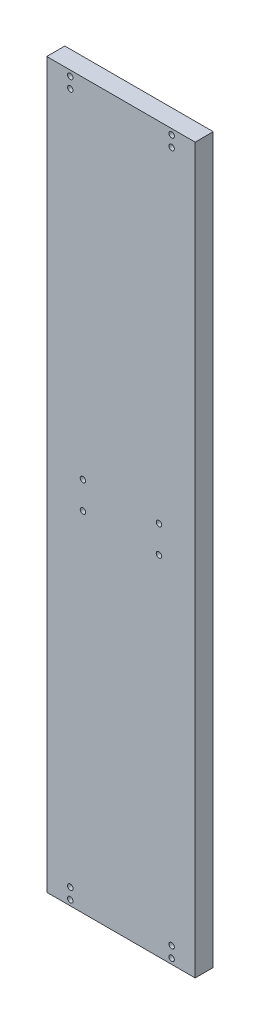
from build123d import *

# Parameters (mm, degrees)
SKETCH_1_W          = 82
SKETCH_1_H          = 400
EXTRUDE_1_DEPTH     = 10
SKETCH_4_R          = 1.5
CUT_EXTRUDE_1_DEPTH = 5
SKETCH_5_R          = 1.5
CUT_EXTRUDE_2_DEPTH = 10


with BuildPart() as part:
    # 草图1 → 凸台-拉伸1 (new body)
    with BuildSketch(Plane.XY):
        Rectangle(SKETCH_1_W, SKETCH_1_H)
    extrude(amount=EXTRUDE_1_DEPTH)

    # 草图4 → 切除-拉伸1 (cut)
    with BuildSketch(Plane.XY.offset(10)):
        with Locations((28, -197)):
            Circle(SKETCH_4_R)
        with Locations((28, -191)):
            Circle(SKETCH_4_R)
        with Locations((-28, -197)):
            Circle(SKETCH_4_R)
        with Locations((-28, -191)):
            Circle(SKETCH_4_R)
    cut_extrude_1 = extrude(amount=-CUT_EXTRUDE_1_DEPTH, mode=Mode.SUBTRACT)

    # 镜向1: 切除-拉伸1 across plane
    add(cut_extrude_1.mirror(Plane.ZX), mode=Mode.SUBTRACT)

    # 草图5 → 切除-拉伸2 (cut)
    with BuildSketch(Plane.XY.offset(10)):
        with Locations((-21, 7.5)):
            Circle(SKETCH_5_R)
        with Locations((-21, -7.5)):
            Circle(SKETCH_5_R)
    cut_extrude_2 = extrude(amount=-CUT_EXTRUDE_2_DEPTH, mode=Mode.SUBTRACT)

    # 镜向2: 切除-拉伸2 across plane
    add(cut_extrude_2.mirror(Plane(origin=(0, 0, 0), x_dir=(0, 0, 1), z_dir=(1, 0, 0))), mode=Mode.SUBTRACT)


solid = part.part
